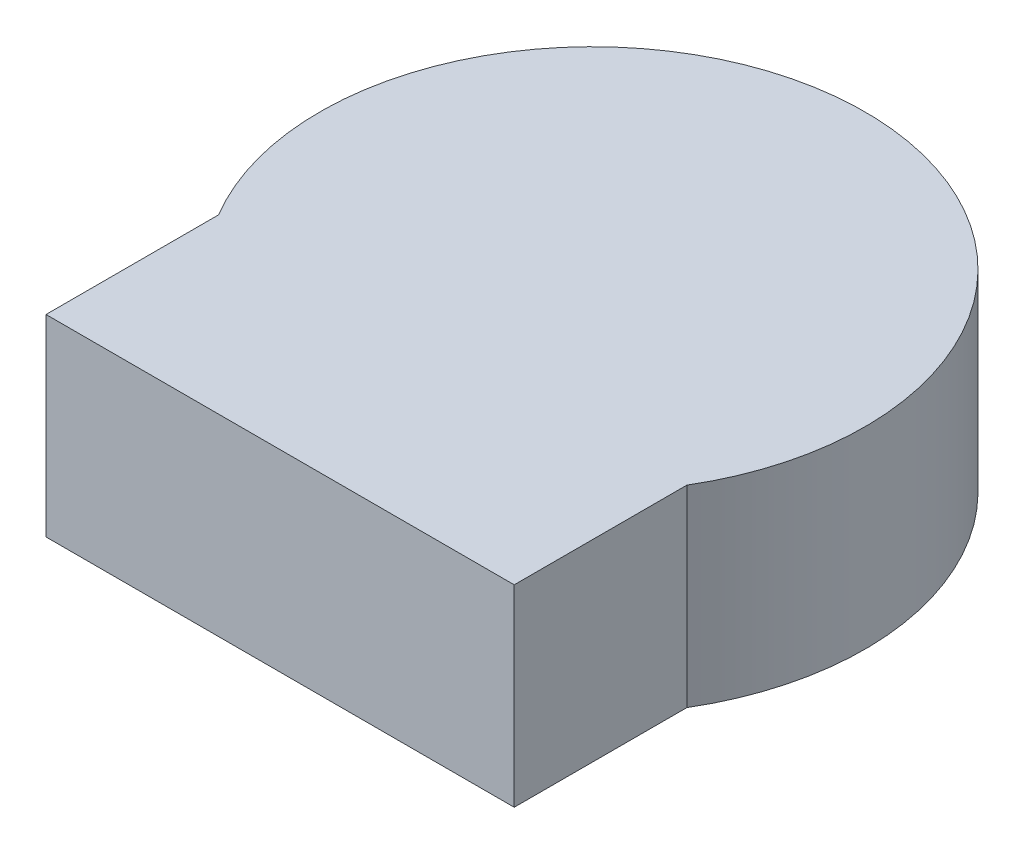
from build123d import *

# Parameters (mm, degrees)
SKETCH1_R           = 70.75
SKETCH1_W           = 121.5
SKETCH1_H           = 44.787071271
BOSS_EXTRUDE1_DEPTH = 50
SKETCH2_R           = 1.5
SKETCH2_R_2         = 2.55
CUT_EXTRUDE1_DEPTH  = 5
CIRPATTERN1_COUNT   = 3


with BuildPart() as part:
    # Sketch1 → Boss-Extrude1 (new body)
    with BuildSketch(Plane(origin=(0, 0, 0), x_dir=(1, 0, 0), z_dir=(0, 1, 0))):
        Circle(SKETCH1_R)
        with Locations((0, -58.656464365)):
            Rectangle(SKETCH1_W, SKETCH1_H)
    extrude(amount=BOSS_EXTRUDE1_DEPTH)

    # Sketch2 → Cut-Extrude1 (cut)
    with BuildSketch(Plane(origin=(0, 0, 0), x_dir=(-1, 0, 0), z_dir=(0, -1, 0))):
        with Locations(Location((0, 50, 0), (0, 0, 90))):
            Circle(SKETCH2_R)
        with Locations(Location((0, 0, 0), (0, 0, 90))):
            Circle(SKETCH2_R_2)
    cut_extrude1 = extrude(amount=-CUT_EXTRUDE1_DEPTH, mode=Mode.SUBTRACT)

    # CirPattern1: Cut-Extrude1 ×3 about axis
    cirpattern1_axis = Axis((0, 0, 0), (0, 1, 0))
    for i in range(1, CIRPATTERN1_COUNT):
        add(cut_extrude1.rotate(cirpattern1_axis, i * 360 / CIRPATTERN1_COUNT), mode=Mode.SUBTRACT)


solid = part.part
